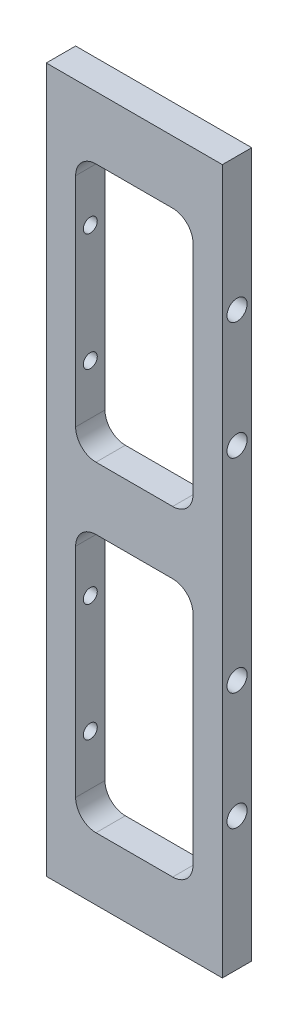
from build123d import *

# Parameters (mm, degrees)
SKETCH1_W                 = 28.575
SKETCH1_H                 = 114.3
BOSS_EXTRUDE1_DEPTH       = 4.7625
SKETCH2_W                 = 19.05
SKETCH2_H                 = 41.91
CUT_EXTRUDE1_DEPTH        = 60.101070739
FILLET1_R                 = 3.302
F_4_CLEARANCE_HOLE1_D     = 3.2639
F_4_CLEARANCE_HOLE1_DEPTH = 4.7625
F_4_40_TAPPED_HOLE1_D     = 2.2606


with BuildPart() as part:
    # Sketch1 → Boss-Extrude1 (new body)
    with BuildSketch(Plane.XY):
        Rectangle(SKETCH1_W, SKETCH1_H)
    extrude(amount=BOSS_EXTRUDE1_DEPTH)

    # Sketch2 → Cut-Extrude1 (cut, through all)
    with BuildSketch(Plane.XY.offset(4.7625)):
        with Locations((0, 26.035)):
            Rectangle(SKETCH2_W, SKETCH2_H)
        with Locations((0, -26.035)):
            Rectangle(SKETCH2_W, SKETCH2_H)
    extrude(amount=-CUT_EXTRUDE1_DEPTH, mode=Mode.SUBTRACT)

    # Fillet1
    fillet1_edges = [part.edges().sort_by_distance(p)[0] for p in [
        (9.525, 46.99, 2.38125),
        (9.525, 5.08, 2.38125),
        (-9.525, 5.08, 2.38125),
        (-9.525, 46.99, 2.38125),
        (-9.525, -46.99, 2.38125),
        (-9.525, -5.08, 2.38125),
        (9.525, -5.08, 2.38125),
        (9.525, -46.99, 2.38125),
    ]]
    fillet(fillet1_edges, radius=FILLET1_R)

    # #4 Clearance Hole1
    with Locations(Plane(origin=(14.2875, 0, 0), x_dir=(0, 0, -1), z_dir=(1, 0, 0))):
        with Locations((-2.38125, 35.56), (-2.38125, 16.51), (-2.38125, -16.51), (-2.38125, -35.56)):
            Hole(F_4_CLEARANCE_HOLE1_D / 2, depth=F_4_CLEARANCE_HOLE1_DEPTH)

    # #4-40 Tapped Hole1 (through all)
    with Locations(Plane.ZY.offset(14.2875)):
        with Locations((2.38125, 16.51), (2.38125, 35.56), (2.38125, -16.51), (2.38125, -35.56)):
            Hole(F_4_40_TAPPED_HOLE1_D / 2)


solid = part.part
